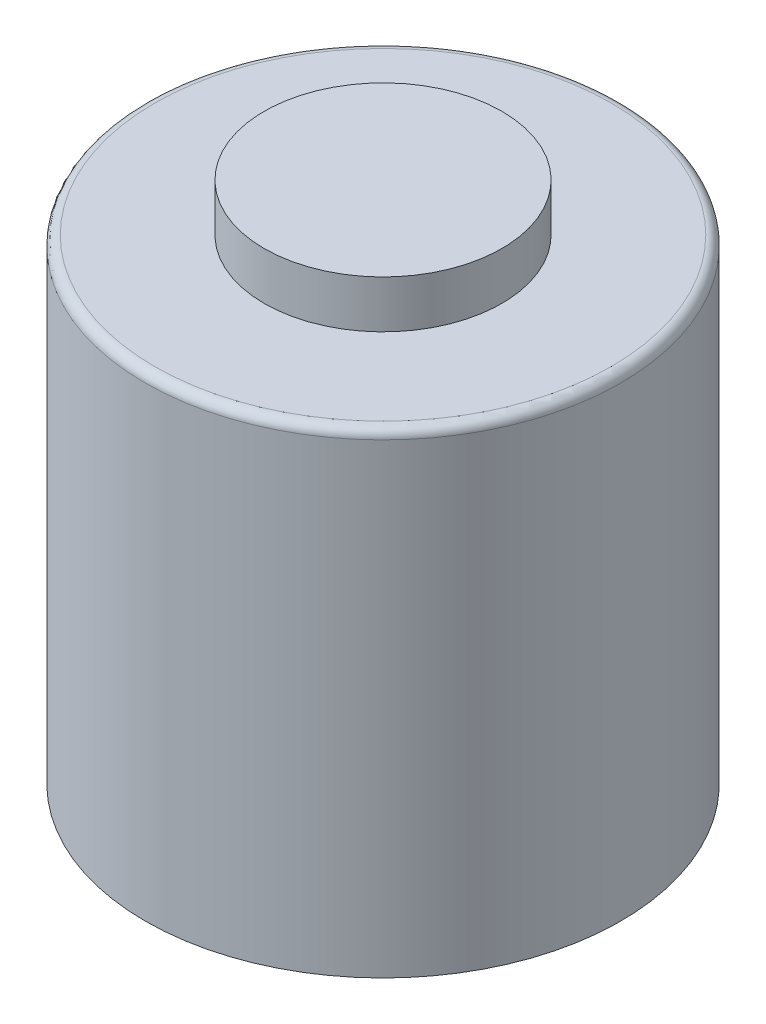
from build123d import *

# Parameters (mm, degrees)
SKETCH1_R           = 250
BOSS_EXTRUDE1_DEPTH = 500
SKETCH2_R           = 125
BOSS_EXTRUDE2_DEPTH = 50
FILLET1_R           = 10


with BuildPart() as part:
    # Sketch1 → Boss-Extrude1 (new body)
    with BuildSketch(Plane(origin=(0, 0, 0), x_dir=(1, 0, 0), z_dir=(0, 1, 0))):
        with Locations(Location((0, 0, 0), (0, 0, 270))):
            Circle(SKETCH1_R)
    extrude(amount=BOSS_EXTRUDE1_DEPTH)

    # Sketch2 → Boss-Extrude2 (add)
    with BuildSketch(Plane(origin=(0, 500, 0), x_dir=(1, 0, 0), z_dir=(0, 1, 0))):
        with Locations(Location((0, 0, 0), (0, 0, 270))):
            Circle(SKETCH2_R)
    extrude(amount=BOSS_EXTRUDE2_DEPTH)

    # Fillet1
    fillet1_edges = [part.edges().sort_by_distance(p)[0] for p in [
        (0, 500, -250),
    ]]
    fillet(fillet1_edges, radius=FILLET1_R)


solid = part.part
